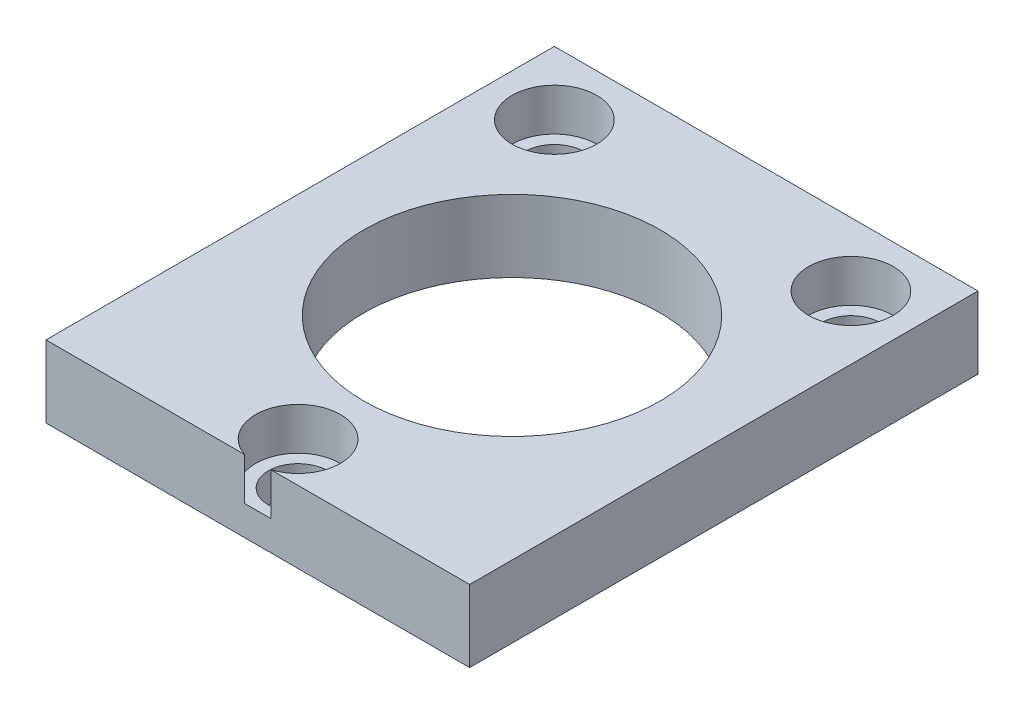
from build123d import *

# Parameters (mm, degrees)
SKETCH_1_W          = 10
SKETCH_1_H          = 12
SKETCH_1_R          = 3.5
EXTRUDE_1_DEPTH     = 1.7
SKETCH_2_R          = 0.7
CUT_EXTRUDE_1_DEPTH = 8.993122043
CUT_EXTRUDE_START   = -1.7
SKETCH_2_3_R        = 1
CUT_EXTRUDE_2_DEPTH = 1


with BuildPart() as part:
    # 草图1 → 凸台-拉伸1 (new body)
    with BuildSketch(Plane(origin=(0, 0, 0), x_dir=(1, 0, 0), z_dir=(0, 1, 0))):
        Rectangle(SKETCH_1_W, SKETCH_1_H)
        with Locations(Location((0, 0, 0), (0, 0, 270))):
            Circle(SKETCH_1_R, mode=Mode.SUBTRACT)
    extrude(amount=EXTRUDE_1_DEPTH)

    # 草图2 → 切除-拉伸1 (cut, through all)
    with BuildSketch(Plane.XZ):
        with Locations(Location((0, 5.05, 0), (0, 0, 270))):
            Circle(SKETCH_2_R)
        with Locations(Location((3.5, -4.5, 0), (0, 0, 270))):
            Circle(SKETCH_2_R)
        with Locations(Location((-3.5, -4.5, 0), (0, 0, 270))):
            Circle(SKETCH_2_R)
    extrude(amount=-CUT_EXTRUDE_1_DEPTH, mode=Mode.SUBTRACT)

    # 草图2<3> → 切除-拉伸2 (cut)
    with BuildSketch(Plane.XZ.offset(CUT_EXTRUDE_START)):
        with Locations((0, 5.05)):
            Circle(SKETCH_2_3_R)
        with Locations(Location((3.5, -4.5, 0), (0, 0, 270))):
            Circle(SKETCH_2_3_R)
        with Locations(Location((-3.5, -4.5, 0), (0, 0, 270))):
            Circle(SKETCH_2_3_R)
    extrude(amount=CUT_EXTRUDE_2_DEPTH, mode=Mode.SUBTRACT)


solid = part.part
